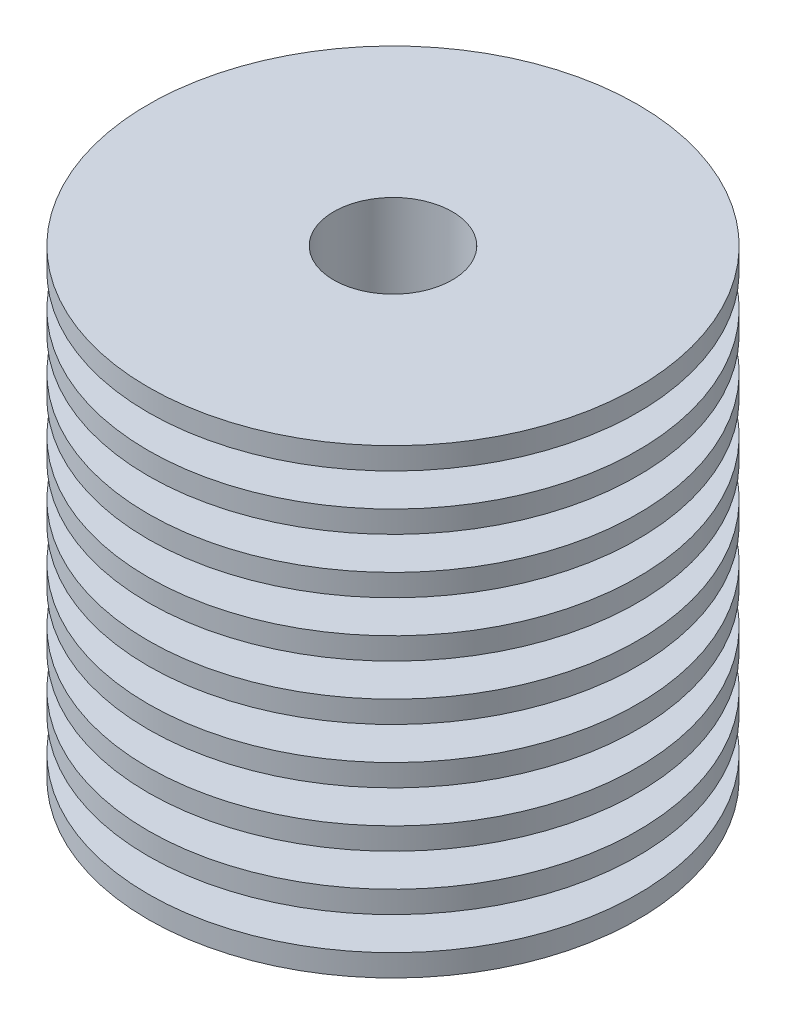
from build123d import *

# Parameters (mm, degrees)
CUT_EXTRUDE_1_REACH = 28.824
SKETCH_1_R          = 11.30959092
CUT_EXTRUDE_2_REACH = 28.261
SKETCH_2_R          = 2.7


with BuildPart() as part:
    # Sketch1 → Revolve1 (revolve)
    with BuildSketch(Plane.XY, mode=Mode.PRIVATE) as revolve1_sk:
        Polygon((11.15, 18.5), (5.082863863, 18.5), (5.082863863, 20), (11.15, 20), (11.15, 21), (4.951844414, 21), (4.951844414, 22.5), (11.15, 22.5), (11.15, 23.5), (4.820824966, 23.5), (4.820824966, 25), (11.15, 25), (11.15, 26), (4.689805518, 26), (4.689805518, 27.5), (8, 27.5), (8, 28.5), (4.689805518, 28.5), (4.689805518, 30), (8, 30), (8, 33), (6, 33), (6, 39), (8, 39), (8, 42.7), (4, 42.7), (4, 36.6), (2.1, 34.7), (2.1, 14.7), (3.5, 13.3), (3.5, 0), (11.15, 0), (11.15, 1), (6, 1), (6, 2.5), (11.15, 2.5), (11.15, 3.5), (5.868980552, 3.5), (5.868980552, 5), (11.15, 5), (11.15, 6), (5.737961104, 6), (5.737961104, 7.5), (11.15, 7.5), (11.15, 8.5), (5.606941655, 8.5), (5.606941655, 10), (11.15, 10), (11.15, 11), (5.475922207, 11), (5.475922207, 12.5), (11.15, 12.5), (11.15, 13.5), (5.344902759, 13.5), (5.344902759, 15), (11.15, 15), (11.15, 16), (5.213883311, 16), (5.213883311, 17.5), (11.15, 17.5), align=None)
    revolve(revolve1_sk.sketch.rotate(Axis((0, 42.7, 0), (0, -1, 0)), 270), axis=Axis((0, 42.7, 0), (0, -1, 0)))

    # Эскиз1 → Вырез-Вытянуть1 (cut, up to next)
    with BuildSketch(Plane(origin=(0, 21, 0), x_dir=(1, 0, 0), z_dir=(0, 1, 0)), mode=Mode.PRIVATE) as cut_extrude_1_sk1:
        Circle(SKETCH_1_R)
    cut_extrude_1_tool1 = extrude(cut_extrude_1_sk1.sketch, amount=CUT_EXTRUDE_1_REACH, mode=Mode.PRIVATE) & part.part
    add(cut_extrude_1_tool1.solids().sort_by_distance((0, 21, 0))[0], mode=Mode.SUBTRACT)

    # Вырез-Вытянуть2: up to this cone (the profile starts outside it)
    cut_extrude_2_end = Plane(origin=(0, 21, 0), z_dir=(0, -1, 0)).offset(4.200001) * Cone(1e-06, 24.561, 24.560999, align=(Align.CENTER, Align.CENTER, Align.MIN), mode=Mode.PRIVATE)
    # Эскиз2 → Вырез-Вытянуть2 (cut, up to the surface)
    with BuildSketch(Plane(origin=(0, 21, 0), x_dir=(1, 0, 0), z_dir=(0, 1, 0)), mode=Mode.PRIVATE) as cut_extrude_2_sk1:
        with Locations(Location((0, 0, 0), (0, 0, 270))):
            Circle(SKETCH_2_R)
    cut_extrude_2_tool1 = extrude(cut_extrude_2_sk1.sketch, amount=-CUT_EXTRUDE_2_REACH, mode=Mode.PRIVATE) - cut_extrude_2_end
    add(cut_extrude_2_tool1.solids().sort_by_distance((0, 21, 0))[0], mode=Mode.SUBTRACT)


solid = part.part
